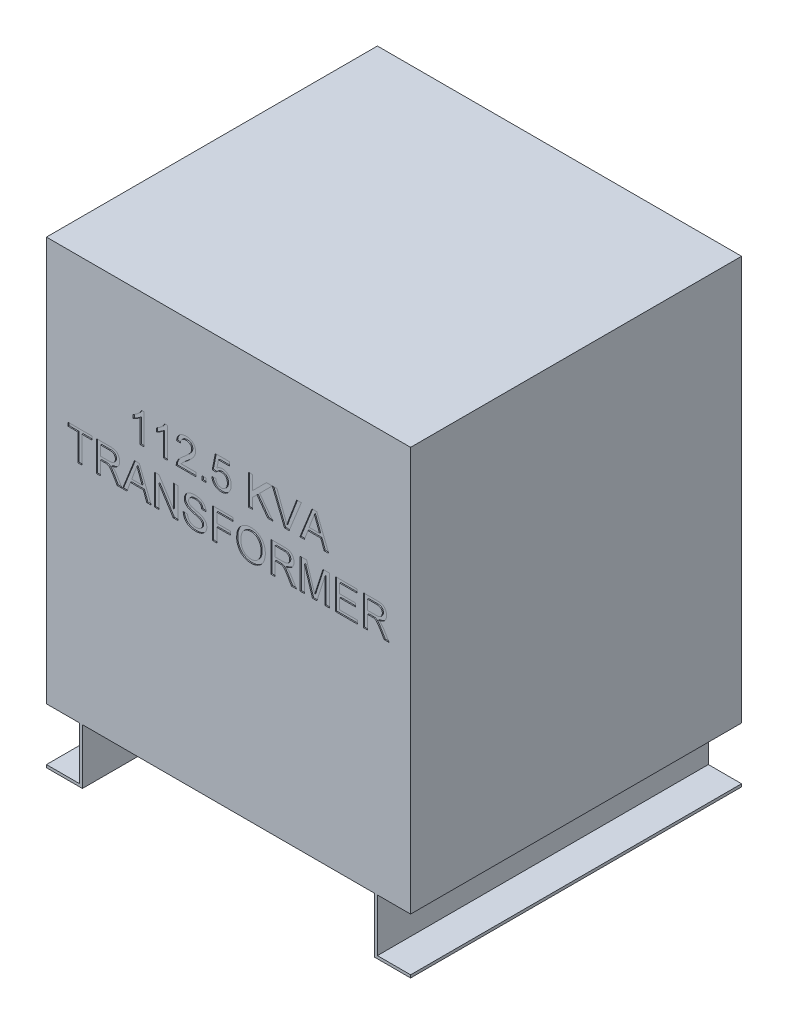
from build123d import *

# Parameters (mm, degrees)
SKETCH1_W           = 835.66
SKETCH1_H           = 759.46
BOSS_EXTRUDE1_DEPTH = 1054.608
SKETCH2_W           = 670.56
SKETCH2_H           = 127
SKETCH2_W_2         = 76.2
SKETCH2_H_2         = 120.65
CUT_EXTRUDE1_DEPTH  = 1366.12249786
SKETCH3_W           = 8.890333909
SKETCH3_H           = 8.890333909
CUT_EXTRUDE2_DEPTH  = 2.54


with BuildPart() as part:
    # Sketch1 → Boss-Extrude1 (new body)
    with BuildSketch(Plane(origin=(0, 0, 0), x_dir=(1, 0, 0), z_dir=(0, 1, 0))):
        Rectangle(SKETCH1_W, SKETCH1_H)
    extrude(amount=BOSS_EXTRUDE1_DEPTH)

    # Sketch2 → Cut-Extrude1 (cut, through all)
    with BuildSketch(Plane.XY.offset(379.73)):
        with Locations((0, 63.5)):
            Rectangle(SKETCH2_W, SKETCH2_H)
        with Locations((-379.73, 66.675)):
            Rectangle(SKETCH2_W_2, SKETCH2_H_2)
        with Locations((379.73, 66.675)):
            Rectangle(SKETCH2_W_2, SKETCH2_H_2)
    extrude(amount=-CUT_EXTRUDE1_DEPTH, mode=Mode.SUBTRACT)

    # Sketch3 → Cut-Extrude2 (cut)
    # profile 1 of 19: a face of its own
    with BuildSketch(Plane.XY.offset(379.73)):
        with BuildLine():
            Line((-193.809279222, 749.808), (-202.699613131, 749.808))
            Line((-202.699613131, 749.808), (-202.699613131, 803.844560792))
            add(Edge.make_bspline(
                [(-202.699613131, 803.844560792), (-203.211519344, 803.350890231), (-204.275460308, 802.324850069), (-206.073940112, 800.872747029), (-208.081273417, 799.400979046), (-210.271393721, 797.985709594), (-212.503850874, 796.653386029), (-214.661233291, 795.455165815), (-216.707522554, 794.441180792), (-218.055424344, 793.88672977), (-218.702214168, 793.620676797)],
                knots=[0, 0, 0, 0, 0.893362401, 1.856755847, 2.901947673, 4.020460078, 5.132200827, 6.168787962, 7.121294059, 8, 8, 8, 8], degree=3))
            Line((-218.702214168, 793.620676797), (-218.702214168, 801.816453369))
            add(Edge.make_bspline(
                [(-218.702214168, 801.816453369), (-217.591285805, 802.3885837), (-215.401711785, 803.516218704), (-212.308317166, 805.463799372), (-209.420300529, 807.57505699), (-206.785469982, 809.849524124), (-204.423512292, 812.17443783), (-202.433056247, 814.52036708), (-200.767569289, 816.801320243), (-199.931962931, 818.392032118), (-199.532431676, 819.152604492)],
                knots=[0, 0, 0, 0, 1.141258006, 2.249351951, 3.335817539, 4.406819942, 5.426913362, 6.360259544, 7.215985427, 8, 8, 8, 8], degree=3))
            Line((-199.532431676, 819.152604492), (-193.809279222, 819.152604492))
            Line((-193.809279222, 819.152604492), (-193.809279222, 749.808))
        make_face()
    # profile 2 of 19: a face of its own
    with BuildSketch(Plane.XY.offset(379.73)):
        with BuildLine():
            Line((-140.467275766, 749.808), (-149.357609675, 749.808))
            Line((-149.357609675, 749.808), (-149.357609675, 803.844560792))
            add(Edge.make_bspline(
                [(-149.357609675, 803.844560792), (-149.869515889, 803.350890231), (-150.933456853, 802.324850069), (-152.731936657, 800.872747029), (-154.739269961, 799.400979046), (-156.929390266, 797.985709594), (-159.161847418, 796.653386029), (-161.319229836, 795.455165815), (-163.365519099, 794.441180792), (-164.713420889, 793.88672977), (-165.360210712, 793.620676797)],
                knots=[0, 0, 0, 0, 0.893362401, 1.856755847, 2.901947673, 4.020460078, 5.132200827, 6.168787962, 7.121294059, 8, 8, 8, 8], degree=3))
            Line((-165.360210712, 793.620676797), (-165.360210712, 801.816453369))
            add(Edge.make_bspline(
                [(-165.360210712, 801.816453369), (-164.24928235, 802.3885837), (-162.05970833, 803.516218704), (-158.966313711, 805.463799372), (-156.078297073, 807.57505699), (-153.443466527, 809.849524124), (-151.081508837, 812.17443783), (-149.091052791, 814.52036708), (-147.425565833, 816.801320243), (-146.589959475, 818.392032118), (-146.19042822, 819.152604492)],
                knots=[0, 0, 0, 0, 1.141258006, 2.249351951, 3.335817539, 4.406819942, 5.426913362, 6.360259544, 7.215985427, 8, 8, 8, 8], degree=3))
            Line((-146.19042822, 819.152604492), (-140.467275766, 819.152604492))
            Line((-140.467275766, 819.152604492), (-140.467275766, 749.808))
        make_face()
    # profile 3 of 19: a face of its own
    with BuildSketch(Plane.XY.offset(379.73)):
        with BuildLine():
            Line((-74.678804838, 758.698333909), (-74.678804838, 749.808))
            Line((-74.678804838, 749.808), (-120.019507775, 749.808))
            add(Edge.make_bspline(
                [(-120.019507775, 749.808), (-120.020436018, 750.336377538), (-120.022289393, 751.391361613), (-119.843769094, 752.951616136), (-119.564170563, 754.491172572), (-119.248028603, 755.478428886), (-119.088800944, 755.97566915)],
                knots=[0, 0, 0, 0, 1.01057331, 2.01775941, 3.001627217, 4, 4, 4, 4], degree=3))
            add(Edge.make_bspline(
                [(-119.088800944, 755.97566915), (-118.794601205, 756.788100418), (-118.195562082, 758.442344284), (-116.981902544, 760.829187169), (-115.554352121, 763.2015949), (-114.164430839, 765.133069743), (-112.891563084, 766.676183111), (-111.824097555, 767.883490735), (-110.641150068, 769.11931236), (-109.343667975, 770.383422244), (-107.944138762, 771.684007516), (-106.440652781, 773.025405576), (-104.815456221, 774.382618005), (-103.680898933, 775.282234872), (-103.100091054, 775.742770951)],
                knots=[0, 0, 0, 0, 1.204657718, 2.452881516, 3.728232997, 5.065887527, 5.768225529, 6.518857853, 7.313994055, 8.154655305, 9.046094665, 9.979688118, 10.965752482, 12, 12, 12, 12], degree=3))
            add(Edge.make_bspline(
                [(-103.100091054, 775.742770951), (-102.207826686, 776.493775384), (-100.489715049, 777.939882058), (-98.063472181, 780.085770335), (-95.84749425, 782.078349148), (-93.87706819, 783.952542514), (-92.136077984, 785.690171969), (-90.620435755, 787.287300687), (-89.31710045, 788.738944353), (-88.241983239, 790.097646317), (-87.334873859, 791.380638897), (-86.566178777, 792.632118928), (-85.925573418, 793.873947026), (-85.392034868, 795.102193707), (-84.970051209, 796.322111502), (-84.682409317, 797.537254588), (-84.487340537, 798.735565791), (-84.467823748, 799.532935363), (-84.458172138, 799.927257413)],
                knots=[0, 0, 0, 0, 1.782554561, 3.432421876, 4.950675607, 6.337395053, 7.588547463, 8.709982106, 9.702713005, 10.569305638, 11.356701089, 12.103210377, 12.812277205, 13.490692607, 14.148717897, 14.782152033, 15.397739362, 16, 16, 16, 16], degree=3))
            add(Edge.make_bspline(
                [(-84.458172138, 799.927257413), (-84.467824909, 800.316978608), (-84.486763122, 801.081590396), (-84.666447943, 802.200594967), (-84.916583624, 803.278223105), (-85.320976889, 804.295075147), (-85.802326615, 805.281264028), (-86.419773819, 806.205627439), (-87.134033306, 807.091202874), (-87.951799967, 807.914641885), (-88.844992667, 808.687159141), (-89.843008224, 809.329308645), (-90.880297248, 809.907434532), (-91.99264534, 810.372280908), (-93.178244991, 810.713625894), (-94.428465593, 810.961354446), (-95.74310876, 811.118427624), (-96.640260309, 811.140179038), (-97.099115665, 811.151303974)],
                knots=[0, 0, 0, 0, 0.988194508, 1.938783882, 2.870742509, 3.789494954, 4.709148727, 5.651055405, 6.603531303, 7.592354411, 8.592907906, 9.593461401, 10.59787167, 11.603930315, 12.645063138, 13.723588815, 14.835711238, 16, 16, 16, 16], degree=3))
            add(Edge.make_bspline(
                [(-97.099115665, 811.151303974), (-97.58113046, 811.140234135), (-98.524468837, 811.118569646), (-99.903376917, 810.960870034), (-101.21241112, 810.719926341), (-102.448446987, 810.351544054), (-103.609980105, 809.887472835), (-104.692279805, 809.303330764), (-105.712678211, 808.64394002), (-106.639039052, 807.86327112), (-107.47673501, 806.997668555), (-108.220414005, 806.055289196), (-108.829747201, 805.017947091), (-109.33295967, 803.90845106), (-109.737584625, 802.723313268), (-110.031328581, 801.453473576), (-110.191479755, 800.102598465), (-110.223684813, 799.177519566), (-110.240140475, 798.704836501)],
                knots=[0, 0, 0, 0, 1.131143733, 2.213731411, 3.253917892, 4.251203413, 5.236093891, 6.184197493, 7.13373276, 8.082770301, 9.020476205, 9.957489029, 10.893177274, 11.836722509, 12.812818608, 13.827831385, 14.890097571, 16, 16, 16, 16], degree=3))
            Line((-110.240140475, 798.704836501), (-119.130474384, 799.593869892))
            add(Edge.make_bspline(
                [(-119.130474384, 799.593869892), (-119.039513638, 800.368684215), (-118.862557337, 801.87601879), (-118.421783332, 804.05913903), (-117.802976517, 806.090066638), (-117.062521938, 807.997117013), (-116.134292356, 809.747826413), (-115.085008713, 811.378406299), (-113.847427065, 812.837141513), (-112.480227691, 814.17001348), (-110.968431423, 815.344624398), (-109.326239246, 816.370810112), (-107.554402354, 817.229151103), (-105.662789255, 817.939821659), (-103.647057267, 818.479025295), (-101.510057991, 818.865685179), (-99.248354748, 819.104026752), (-97.697024959, 819.136180871), (-96.904639611, 819.152604492)],
                knots=[0, 0, 0, 0, 1.130804643, 2.199883102, 3.223565206, 4.205909148, 5.160801384, 6.091796021, 7.01151579, 7.927798993, 8.855738875, 9.7815393, 10.730299821, 11.705391175, 12.706931101, 13.751121791, 14.851322166, 16, 16, 16, 16], degree=3))
            add(Edge.make_bspline(
                [(-96.904639611, 819.152604492), (-96.10276985, 819.138873382), (-94.540722832, 819.112125098), (-92.264569255, 818.83843645), (-90.116955446, 818.412168876), (-88.090008314, 817.818082383), (-86.195703344, 817.039057835), (-84.432583378, 816.087265743), (-82.792519037, 814.971990569), (-81.302912433, 813.679844157), (-79.959695218, 812.269249897), (-78.782563391, 810.763841736), (-77.79842452, 809.170050806), (-76.960491372, 807.509601581), (-76.33896543, 805.74740985), (-75.901896935, 803.907432946), (-75.604896217, 801.988098554), (-75.580355114, 800.678532309), (-75.567838229, 800.010604294)],
                knots=[0, 0, 0, 0, 1.195390245, 2.328627238, 3.413424916, 4.457841177, 5.473507151, 6.462241215, 7.441013641, 8.425227782, 9.397253344, 10.342087291, 11.269524934, 12.186751184, 13.110685745, 14.048630397, 15.004728144, 16, 16, 16, 16], degree=3))
            add(Edge.make_bspline(
                [(-75.567838229, 800.010604294), (-75.586951309, 799.324383939), (-75.62521965, 797.950428858), (-75.923909145, 795.896771212), (-76.434970205, 793.86540032), (-77.11250077, 791.831593184), (-78.038148538, 789.787277707), (-79.207547309, 787.704252504), (-80.658314264, 785.574823059), (-82.05354532, 783.764571451), (-83.352278987, 782.247124109), (-84.503483646, 780.998176287), (-85.835360809, 779.671252745), (-87.29794678, 778.220399052), (-88.950892845, 776.697109039), (-90.746706021, 775.055766906), (-92.724697507, 773.339566534), (-94.097809094, 772.16714082), (-94.807076454, 771.561535784)],
                knots=[0, 0, 0, 0, 0.927118007, 1.856282007, 2.79721255, 3.754929441, 4.749232485, 5.824981375, 6.979078785, 8.228161913, 8.911614355, 9.677694854, 10.522803217, 11.452009355, 12.461436787, 13.560019032, 14.739651695, 16, 16, 16, 16], degree=3))
            add(Edge.make_bspline(
                [(-94.807076454, 771.561535784), (-95.414456817, 771.067063422), (-96.572637676, 770.12418074), (-98.220374319, 768.757258456), (-99.696245181, 767.503827753), (-101.034763268, 766.404773173), (-102.18718063, 765.406934818), (-103.194089542, 764.554013652), (-104.018908458, 763.803125112), (-105.274961642, 762.66251027), (-106.865860167, 761.036679096), (-108.038102245, 759.456904364), (-108.60098516, 758.698333909)],
                knots=[0, 0, 0, 0, 1.241996727, 2.368296581, 3.394949853, 4.3125351, 5.114548721, 5.812230366, 6.404953749, 6.883082049, 8.503329734, 10, 10, 10, 10], degree=3))
            Line((-108.60098516, 758.698333909), (-74.678804838, 758.698333909))
        make_face()
    # profile 4 of 19: a face of its own
    with BuildSketch(Plane.XY.offset(379.73)):
        with Locations((-56.009103629, 754.253166955)):
            Rectangle(SKETCH3_W, SKETCH3_H)
    # profile 5 of 19: a face of its own
    with BuildSketch(Plane.XY.offset(379.73)):
        with BuildLine():
            Line((-38.22843581, 768.477701209), (-29.338101901, 769.3667346))
            add(Edge.make_bspline(
                [(-29.338101901, 769.3667346), (-29.250073638, 768.865813077), (-29.078844975, 767.891442808), (-28.752549835, 766.481012942), (-28.32878533, 765.170684174), (-27.852639255, 763.949108308), (-27.286659318, 762.829201978), (-26.673415366, 761.79328245), (-25.950219453, 760.878121638), (-25.189876052, 760.035855768), (-24.355341072, 759.29367058), (-23.438561873, 758.667982862), (-22.465117198, 758.122108216), (-21.423150858, 757.675170308), (-20.311065916, 757.348035297), (-19.143016243, 757.089327663), (-17.903961086, 756.958966107), (-17.058562209, 756.933331743), (-16.62770264, 756.920267127)],
                knots=[0, 0, 0, 0, 1.237781394, 2.407677316, 3.51963579, 4.58689595, 5.594855907, 6.570874, 7.510833816, 8.428091223, 9.330271693, 10.221190844, 11.124215526, 12.043132878, 12.973586933, 13.941700858, 14.950982896, 16, 16, 16, 16], degree=3))
            add(Edge.make_bspline(
                [(-16.62770264, 756.920267127), (-16.09913447, 756.933038869), (-15.065496386, 756.958014565), (-13.561748774, 757.169248973), (-12.141337369, 757.517550039), (-10.811058621, 758.004971506), (-9.555317593, 758.611137775), (-8.415772728, 759.396012674), (-7.330289758, 760.278289615), (-6.368719759, 761.330133056), (-5.4934209, 762.475240339), (-4.737972179, 763.72517365), (-4.101991091, 765.062389184), (-3.566564528, 766.486630573), (-3.171191083, 768.006034014), (-2.880361979, 769.61251657), (-2.693661304, 771.307101572), (-2.676079434, 772.468592841), (-2.667100173, 773.061779631)],
                knots=[0, 0, 0, 0, 1.052816602, 2.058828735, 3.018813999, 3.961574988, 4.877590722, 5.788574389, 6.712363302, 7.658909047, 8.620312049, 9.580784896, 10.562948504, 11.56722449, 12.607883026, 13.686460295, 14.818448981, 16, 16, 16, 16], degree=3))
            add(Edge.make_bspline(
                [(-2.667100173, 773.061779631), (-2.677305855, 773.627078913), (-2.697178686, 774.727847723), (-2.864540342, 776.330750132), (-3.146899158, 777.837963479), (-3.512245029, 779.266099888), (-4.015828231, 780.592842967), (-4.613106264, 781.837429194), (-5.344796957, 782.973444785), (-6.158851136, 784.036261152), (-7.088603782, 784.989033199), (-8.146615697, 785.793528516), (-9.291381699, 786.497624387), (-10.545958548, 787.068602215), (-11.911084999, 787.492817285), (-13.373195458, 787.81921261), (-14.947461485, 787.990883186), (-16.030027647, 788.020978817), (-16.586029199, 788.03643581)],
                knots=[0, 0, 0, 0, 1.165854935, 2.270189951, 3.319242023, 4.32700288, 5.306253956, 6.24172124, 7.169108591, 8.088047231, 8.999810445, 9.905349262, 10.822648491, 11.767237767, 12.739852311, 13.766490849, 14.852878837, 16, 16, 16, 16], degree=3))
            add(Edge.make_bspline(
                [(-16.586029199, 788.03643581), (-17.277390149, 788.016212151), (-18.603263991, 787.977427749), (-20.508408356, 787.651148487), (-22.242730248, 787.124085902), (-23.786593733, 786.338563242), (-25.165959469, 785.400127398), (-26.409483036, 784.338244667), (-27.527418549, 783.153632978), (-28.140651691, 782.261757873), (-28.44906851, 781.813202073)],
                knots=[0, 0, 0, 0, 1.182877094, 2.268490576, 3.298955169, 4.273890847, 5.221533034, 6.149304476, 7.069219215, 8, 8, 8, 8], degree=3))
            Line((-28.44906851, 781.813202073), (-37.339402419, 782.702235464))
            Line((-37.339402419, 782.702235464), (-30.227135291, 818.263571101))
            Line((-30.227135291, 818.263571101), (2.667100173, 818.263571101))
            Line((2.667100173, 818.263571101), (2.667100173, 809.373237192))
            Line((2.667100173, 809.373237192), (-22.96206555, 809.373237192))
            Line((-22.96206555, 809.373237192), (-26.49041682, 791.411984466))
            add(Edge.make_bspline(
                [(-26.49041682, 791.411984466), (-25.999872004, 791.780096172), (-25.036519582, 792.503009332), (-23.533862478, 793.449568826), (-22.009718954, 794.247455363), (-20.472961438, 794.900857341), (-18.911382802, 795.409856333), (-17.334406336, 795.763485329), (-15.7366627, 796.002488612), (-14.665281356, 796.025953588), (-14.127296228, 796.037736328)],
                knots=[0, 0, 0, 0, 1.093835215, 2.148119334, 3.164235237, 4.159999629, 5.123971815, 6.089888814, 7.040853737, 8, 8, 8, 8], degree=3))
            add(Edge.make_bspline(
                [(-14.127296228, 796.037736328), (-13.42714505, 796.019391812), (-12.048377578, 795.98326701), (-10.016715967, 795.68645628), (-8.074105704, 795.182600389), (-6.205309117, 794.503979962), (-4.434968471, 793.604352659), (-2.745151487, 792.515095021), (-1.142680542, 791.2272286), (0.363385135, 789.76505278), (1.7294466, 788.141883902), (2.952116196, 786.410659401), (3.950725936, 784.536724924), (4.790625266, 782.569009221), (5.424095324, 780.475211525), (5.904921208, 778.285047101), (6.162002846, 775.971133893), (6.202503999, 774.395897638), (6.223233736, 773.589643207)],
                knots=[0, 0, 0, 0, 0.991958705, 1.953407265, 2.902004973, 3.832128134, 4.765371166, 5.71007953, 6.676509202, 7.674246545, 8.68000108, 9.679398714, 10.671856529, 11.683459888, 12.706765812, 13.76733029, 14.85725088, 16, 16, 16, 16], degree=3))
            add(Edge.make_bspline(
                [(6.223233736, 773.589643207), (6.207492545, 772.820343932), (6.176399202, 771.30075835), (5.921582818, 769.061368079), (5.501833385, 766.903539289), (4.939904718, 764.820881985), (4.18066368, 762.825224051), (3.259775365, 760.910119348), (2.197479041, 759.055584408), (1.345572517, 757.912370652), (0.916815684, 757.337001529)],
                knots=[0, 0, 0, 0, 1.059692978, 2.093196008, 3.100373587, 4.086253034, 5.061402885, 6.037282833, 7.012182238, 8, 8, 8, 8], degree=3))
            add(Edge.make_bspline(
                [(0.916815684, 757.337001529), (0.37209215, 756.665364686), (-0.699437527, 755.344182905), (-2.554779465, 753.629368029), (-4.549298354, 752.172011385), (-6.694863817, 750.988014729), (-8.977071979, 750.036573155), (-11.423959143, 749.403424514), (-14.005958885, 748.978240122), (-15.778551803, 748.938996301), (-16.683267227, 748.918966609)],
                knots=[0, 0, 0, 0, 1.023140956, 2.012628108, 2.982342558, 3.942221589, 4.908720554, 5.902469194, 6.929439212, 8, 8, 8, 8], degree=3))
            add(Edge.make_bspline(
                [(-16.683267227, 748.918966609), (-17.429513912, 748.934104101), (-18.889322223, 748.963716075), (-21.026741324, 749.221148548), (-23.059679641, 749.631662569), (-24.988774062, 750.220466755), (-26.819836429, 750.964475948), (-28.531583027, 751.90962274), (-30.153719375, 752.990811801), (-31.650563878, 754.241354369), (-33.014384112, 755.636190099), (-34.236394739, 757.145765428), (-35.300058627, 758.771064709), (-36.204862399, 760.502362513), (-36.958974562, 762.337998475), (-37.535900183, 764.290501514), (-37.992873285, 766.340714566), (-38.149091657, 767.757903382), (-38.22843581, 768.477701209)],
                knots=[0, 0, 0, 0, 1.108768375, 2.168973506, 3.19473529, 4.187459816, 5.162590879, 6.12651078, 7.088512529, 8.056012598, 9.019588496, 9.983680353, 10.938070192, 11.90157236, 12.88306954, 13.882379887, 14.924449348, 16, 16, 16, 16], degree=3))
        make_face()
    # profile 6 of 19: a face of its own
    with BuildSketch(Plane.XY.offset(379.73)):
        Polygon((45.340702937, 749.808), (45.340702937, 819.152604492), (55.120070237, 819.152604492), (55.120070237, 787.202967006), (87.069707724, 819.152604492), (100.460773175, 819.152604492), (71.483841089, 790.175672407), (102.238839956, 749.808), (90.195215739, 749.808), (65.288389646, 783.966329817), (55.120070237, 773.811901555), (55.120070237, 749.808), align=None)
    # profile 7 of 19: a face of its own
    with BuildSketch(Plane.XY.offset(379.73)):
        with BuildLine():
            Line((128.493107282, 749.808), (100.530228908, 819.152604492))
            Line((100.530228908, 819.152604492), (111.129173866, 819.152604492))
            Line((111.129173866, 819.152604492), (129.993351129, 769.450081481))
            add(Edge.make_bspline(
                [(129.993351129, 769.450081481), (130.36250438, 768.469677885), (131.084644272, 766.551806254), (132.091668925, 763.705816244), (132.99188834, 760.953598841), (133.534619226, 759.139349514), (133.799525334, 758.253817214)],
                knots=[0, 0, 0, 0, 1.062747156, 2.078952616, 3.062339733, 4, 4, 4, 4], degree=3))
            add(Edge.make_bspline(
                [(133.799525334, 758.253817214), (134.36347141, 760.126408418), (135.499449182, 763.898439252), (136.872575929, 767.590773683), (137.564026099, 769.450081481)],
                knots=[0, 0, 0, 0, 0.992882236, 2, 2, 2, 2], degree=3))
            Line((137.564026099, 769.450081481), (156.469876803, 819.152604492))
            Line((156.469876803, 819.152604492), (167.06882176, 819.152604492))
            Line((167.06882176, 819.152604492), (139.09205224, 749.808))
            Line((139.09205224, 749.808), (128.493107282, 749.808))
        make_face()
    # profile 8 of 19: a face of its own
    with BuildSketch(Plane.XY.offset(379.73)):
        Polygon((163.873858012, 749.808), (191.406110837, 819.152604492), (202.435681343, 819.152604492), (229.967934168, 749.808), (219.591247559, 749.808), (211.701076214, 771.144801382), (182.140715966, 771.144801382), (174.250544621, 749.808), align=None)
        with BuildLine():
            Line((185.085639073, 779.146101901), (208.756153107, 779.146101901))
            Line((208.756153107, 779.146101901), (202.018946941, 797.371286415))
            add(Edge.make_bspline(
                [(202.018946941, 797.371286415), (201.76066651, 798.075482707), (201.255679502, 799.452319422), (200.502591732, 801.452746939), (199.814582881, 803.352435016), (199.139933705, 805.124144846), (198.530915843, 806.793612296), (197.96956847, 808.349560868), (197.414400654, 809.781175976), (197.081236638, 810.706146847), (196.92089609, 811.151303974)],
                knots=[0, 0, 0, 0, 1.225184869, 2.395467751, 3.491410812, 4.525364584, 5.492066482, 6.394148129, 7.227157926, 8, 8, 8, 8], degree=3))
            add(Edge.make_bspline(
                [(196.92089609, 811.151303974), (196.655661875, 810.053585701), (196.124099802, 807.853622918), (195.01113824, 804.630382311), (193.737948868, 801.436619695), (192.70396739, 799.378580867), (192.184015054, 798.343666686)],
                knots=[0, 0, 0, 0, 0.9891762, 1.982431084, 2.985436691, 4, 4, 4, 4], degree=3))
            Line((192.184015054, 798.343666686), (185.085639073, 779.146101901))
        make_face(mode=Mode.SUBTRACT)
    # profile 9 of 19: a face of its own
    with BuildSketch(Plane.XY.offset(379.73)):
        Polygon((-345.83398907, 642.123993089), (-345.83398907, 703.467297063), (-368.059823843, 703.467297063), (-368.059823843, 711.468597581), (-313.828786997, 711.468597581), (-313.828786997, 703.467297063), (-336.05462177, 703.467297063), (-336.05462177, 642.123993089), align=None)
    # profile 10 of 19: a face of its own
    with BuildSketch(Plane.XY.offset(379.73)):
        with BuildLine():
            Line((-303.160386306, 642.123993089), (-303.160386306, 711.468597581))
            Line((-303.160386306, 711.468597581), (-273.072162481, 711.468597581))
            add(Edge.make_bspline(
                [(-273.072162481, 711.468597581), (-272.36367694, 711.463046304), (-270.9924861, 711.452302456), (-269.003976261, 711.376248216), (-267.147901674, 711.212295227), (-265.420849637, 711.035002919), (-263.823126999, 710.762882906), (-262.356382086, 710.450767398), (-261.018350318, 710.079345224), (-259.803049885, 709.640667005), (-258.675516081, 709.144368317), (-257.630377412, 708.532015865), (-256.624188813, 707.861008146), (-255.694293451, 707.072674213), (-254.816165247, 706.209521525), (-253.990618076, 705.259821668), (-253.229873508, 704.215333178), (-252.291586187, 702.720453542), (-251.284995194, 700.729588665), (-250.446346788, 698.181712997), (-249.905601299, 695.51654205), (-249.847739986, 693.695206453), (-249.81838285, 692.771114078)],
                knots=[0, 0, 0, 0, 1.242255013, 2.404239178, 3.487702428, 4.508875116, 5.447164253, 6.327763259, 7.137389581, 7.87956647, 8.591787438, 9.293660819, 10.000726923, 10.709654955, 11.427269343, 12.158170644, 12.913245971, 13.690346794, 15.251572448, 16.809945773, 18.381459854, 20, 20, 20, 20], degree=3))
            add(Edge.make_bspline(
                [(-249.81838285, 692.771114078), (-249.831952384, 692.177929187), (-249.858753145, 691.006348348), (-250.064049669, 689.283810919), (-250.435517153, 687.637995671), (-250.911850984, 686.054488851), (-251.563806684, 684.555726219), (-252.319069065, 683.111095092), (-253.254731775, 681.760283341), (-254.302309647, 680.467321014), (-255.503600543, 679.259899913), (-256.869172193, 678.181580823), (-258.385488, 677.211630642), (-260.059689201, 676.376810674), (-261.872504058, 675.61374559), (-263.846678418, 674.999288818), (-265.974244677, 674.497537746), (-267.449172505, 674.254570514), (-268.210261125, 674.129195162)],
                knots=[0, 0, 0, 0, 0.982609109, 1.940720374, 2.867584677, 3.775009516, 4.675469332, 5.571146231, 6.471115823, 7.392408543, 8.32534739, 9.286126426, 10.269214477, 11.301811357, 12.381622301, 13.524260118, 14.722474812, 16, 16, 16, 16], degree=3))
            add(Edge.make_bspline(
                [(-268.210261125, 674.129195162), (-267.651973788, 673.847160714), (-266.591766037, 673.311567144), (-265.123895269, 672.471761078), (-263.87963203, 671.613686224), (-263.158767285, 670.999965866), (-262.820496192, 670.711973066)],
                knots=[0, 0, 0, 0, 1.172304973, 2.226249348, 3.167654437, 4, 4, 4, 4], degree=3))
            add(Edge.make_bspline(
                [(-262.820496192, 670.711973066), (-262.165415109, 670.069802167), (-260.819832026, 668.750737521), (-258.96556009, 666.503984026), (-257.167779766, 664.003002627), (-256.075492667, 662.195534894), (-255.513753011, 661.265993287)],
                knots=[0, 0, 0, 0, 0.918110279, 1.885863737, 2.912745394, 4, 4, 4, 4], degree=3))
            Line((-255.513753011, 661.265993287), (-244.136903836, 642.123993089))
            Line((-244.136903836, 642.123993089), (-255.34705925, 642.123993089))
            Line((-255.34705925, 642.123993089), (-263.987352518, 656.765261746))
            add(Edge.make_bspline(
                [(-263.987352518, 656.765261746), (-264.298014064, 657.278968255), (-264.90002513, 658.274447121), (-265.769608548, 659.728296082), (-266.622206498, 661.066795697), (-267.412976514, 662.328201014), (-268.174009367, 663.489611841), (-268.8979517, 664.555062694), (-269.564880296, 665.538530895), (-270.390957586, 666.683543818), (-271.35237435, 667.950511244), (-272.474281748, 669.255248444), (-273.542670223, 670.295498034), (-274.858410349, 671.315573413), (-276.488153549, 672.269682465), (-277.873466034, 672.708069363), (-278.545274294, 672.920665396)],
                knots=[0, 0, 0, 0, 1.130940588, 2.191577161, 3.191089816, 4.120344442, 4.99615009, 5.80661983, 6.546979556, 7.234477901, 8.466216387, 9.541989141, 10.473533583, 11.269175393, 12.675684693, 14, 14, 14, 14], degree=3))
            add(Edge.make_bspline(
                [(-278.545274294, 672.920665396), (-278.827140141, 672.971495388), (-279.47064832, 673.087541783), (-280.563323601, 673.163331869), (-281.887233756, 673.243772905), (-282.846694007, 673.241429123), (-283.365502211, 673.240161771)],
                knots=[0, 0, 0, 0, 0.709978628, 1.620902492, 2.713552433, 4, 4, 4, 4], degree=3))
            Line((-283.365502211, 673.240161771), (-293.381019005, 673.240161771))
            Line((-293.381019005, 673.240161771), (-293.381019005, 642.123993089))
            Line((-293.381019005, 642.123993089), (-303.160386306, 642.123993089))
        make_face()
        with BuildLine():
            Line((-293.381019005, 681.24146229), (-274.808555823, 681.24146229))
            add(Edge.make_bspline(
                [(-274.808555823, 681.24146229), (-273.877262169, 681.256033262), (-272.136296032, 681.283272328), (-269.701830309, 681.515865324), (-267.627123845, 681.885465472), (-265.871162653, 682.424570574), (-264.39587808, 683.173027479), (-263.112795056, 684.085162079), (-262.046536912, 685.22770562), (-261.15952028, 686.516822752), (-260.470024055, 687.935431807), (-259.972654365, 689.425472631), (-259.647117252, 690.974422396), (-259.614351598, 692.028616163), (-259.59775015, 692.562746877)],
                knots=[0, 0, 0, 0, 1.546323217, 2.890706218, 4.056530419, 5.041445823, 5.928701482, 6.793137403, 7.641659452, 8.509781392, 9.383301667, 10.251423607, 11.114044887, 12, 12, 12, 12], degree=3))
            add(Edge.make_bspline(
                [(-259.59775015, 692.562746877), (-259.610657082, 692.951988239), (-259.63593797, 693.714397723), (-259.768468746, 694.833403171), (-260.026140039, 695.896716994), (-260.36639435, 696.90995999), (-260.821043155, 697.865710878), (-261.361147388, 698.771375671), (-262.005658474, 699.621934809), (-262.743908839, 700.419979225), (-263.591554418, 701.146121652), (-264.559764947, 701.772625071), (-265.640904205, 702.30501782), (-266.836228841, 702.727560296), (-268.141973364, 703.065525495), (-269.565571091, 703.290362841), (-271.100511604, 703.453054395), (-272.164136366, 703.462460811), (-272.710992666, 703.467297063)],
                knots=[0, 0, 0, 0, 0.965208469, 1.890559848, 2.786986821, 3.67262109, 4.535197034, 5.405224191, 6.282113641, 7.175449223, 8.095446547, 9.040936516, 10.026471658, 11.075712529, 12.17809725, 13.364958037, 14.645208957, 16, 16, 16, 16], degree=3))
            Line((-272.710992666, 703.467297063), (-293.381019005, 703.467297063))
            Line((-293.381019005, 703.467297063), (-293.381019005, 681.24146229))
        make_face(mode=Mode.SUBTRACT)
    # profile 11 of 19: a face of its own
    with BuildSketch(Plane.XY.offset(379.73)):
        Polygon((-243.303435032, 642.123993089), (-215.771182207, 711.468597581), (-204.741611701, 711.468597581), (-177.209358876, 642.123993089), (-187.586045485, 642.123993089), (-195.47621683, 663.460794471), (-225.036577078, 663.460794471), (-232.926748422, 642.123993089), align=None)
        with BuildLine():
            Line((-222.091653971, 671.462094989), (-198.421139937, 671.462094989))
            Line((-198.421139937, 671.462094989), (-205.158346103, 689.687279503))
            add(Edge.make_bspline(
                [(-205.158346103, 689.687279503), (-205.416626533, 690.391475796), (-205.921613542, 691.768312511), (-206.674701312, 693.768740028), (-207.362710163, 695.668428105), (-208.037359339, 697.440137935), (-208.646377201, 699.109605385), (-209.207724574, 700.665553957), (-209.76289239, 702.097169065), (-210.096056406, 703.022139936), (-210.256396954, 703.467297063)],
                knots=[0, 0, 0, 0, 1.225184869, 2.395467751, 3.491410812, 4.525364584, 5.492066482, 6.394148129, 7.227157926, 8, 8, 8, 8], degree=3))
            add(Edge.make_bspline(
                [(-210.256396954, 703.467297063), (-210.521631169, 702.369578789), (-211.053193242, 700.169616007), (-212.166154804, 696.9463754), (-213.439344175, 693.752612784), (-214.473325654, 691.694573956), (-214.99327799, 690.659659775)],
                knots=[0, 0, 0, 0, 0.9891762, 1.982431084, 2.985436691, 4, 4, 4, 4], degree=3))
            Line((-214.99327799, 690.659659775), (-222.091653971, 671.462094989))
        make_face(mode=Mode.SUBTRACT)
    # profile 12 of 19: a face of its own
    with BuildSketch(Plane.XY.offset(379.73)):
        Polygon((-169.805377667, 642.123993089), (-169.805377667, 711.468597581), (-159.470364497, 711.468597581), (-126.242741511, 659.724076), (-126.242741511, 711.468597581), (-116.463374211, 711.468597581), (-116.463374211, 642.123993089), (-126.798387381, 642.123993089), (-160.026010367, 693.86851467), (-160.026010367, 642.123993089), align=None)
    # profile 13 of 19: a face of its own
    with BuildSketch(Plane.XY.offset(379.73)):
        with BuildLine():
            Line((-104.016906738, 666.127894644), (-94.237539438, 666.127894644))
            add(Edge.make_bspline(
                [(-94.237539438, 666.127894644), (-94.129972071, 665.249841937), (-93.923329367, 663.563055405), (-93.345535727, 661.172289419), (-92.601878031, 659.022745439), (-91.675301043, 657.085895221), (-90.45642432, 655.384961483), (-88.987887533, 653.850745227), (-87.20442953, 652.52220685), (-85.191311995, 651.339894737), (-82.949260881, 650.411592733), (-80.555671356, 649.723427176), (-78.021958756, 649.3156836), (-76.287028291, 649.263106793), (-75.401144468, 649.236260216)],
                knots=[0, 0, 0, 0, 1.125557648, 2.162256852, 3.1243583, 4.018160113, 4.88511607, 5.777380551, 6.711250965, 7.707237736, 8.743031335, 9.791730543, 10.872421559, 12, 12, 12, 12], degree=3))
            add(Edge.make_bspline(
                [(-75.401144468, 649.236260216), (-74.617213579, 649.250769942), (-73.088700145, 649.279061098), (-70.877534614, 649.618907969), (-68.796821423, 650.100971625), (-66.885284817, 650.830168378), (-65.149976258, 651.715641876), (-63.643055184, 652.786642837), (-62.356526129, 653.994437718), (-61.349080626, 655.370839167), (-60.557651555, 656.813077714), (-59.977056517, 658.295550196), (-59.631207951, 659.81002821), (-59.58713785, 660.829047099), (-59.565237192, 661.335449021)],
                knots=[0, 0, 0, 0, 1.267006637, 2.470417599, 3.611360613, 4.716023143, 5.771382139, 6.754486395, 7.697536124, 8.612899418, 9.501261124, 10.352596716, 11.181322154, 12, 12, 12, 12], degree=3))
            add(Edge.make_bspline(
                [(-59.565237192, 661.335449021), (-59.588649402, 661.836721383), (-59.634408534, 662.8164575), (-59.932608119, 664.242830901), (-60.49937857, 665.548376875), (-61.234828363, 666.786381721), (-62.257964597, 667.918268936), (-63.550581765, 668.961202041), (-65.141159468, 669.906735293), (-66.328286428, 670.424564416), (-66.955327254, 670.698081919)],
                knots=[0, 0, 0, 0, 0.942140154, 1.841411588, 2.718743672, 3.605002079, 4.535543111, 5.568170452, 6.715506882, 8, 8, 8, 8], degree=3))
            add(Edge.make_bspline(
                [(-66.955327254, 670.698081919), (-67.199631633, 670.798336374), (-67.751559607, 671.024829401), (-68.697538255, 671.324667171), (-69.820061721, 671.712388002), (-71.146097729, 672.111677356), (-72.668547426, 672.534069649), (-74.384876086, 673.012153685), (-76.294124652, 673.520569889), (-78.342143539, 674.061723559), (-80.410018519, 674.611993854), (-82.385631482, 675.162779467), (-84.203289328, 675.721897417), (-85.87788113, 676.26025081), (-87.400773604, 676.800825276), (-88.776289069, 677.328821047), (-90.006142459, 677.833525789), (-90.757290091, 678.204627445), (-91.112031423, 678.379886063)],
                knots=[0, 0, 0, 0, 0.499201778, 1.127787504, 1.87543728, 2.745208432, 3.745951656, 4.863402235, 6.114490242, 7.482339553, 8.869366102, 10.161191451, 11.360587006, 12.46547846, 13.487450326, 14.41601931, 15.251940103, 16, 16, 16, 16], degree=3))
            add(Edge.make_bspline(
                [(-91.112031423, 678.379886063), (-91.928192283, 678.82079967), (-93.50359515, 679.67187768), (-95.623912926, 681.193607543), (-97.410495901, 682.882248479), (-98.855806832, 684.735351886), (-99.988440453, 686.721577338), (-100.752623405, 688.844301436), (-101.276025643, 691.064992772), (-101.324938946, 692.592066229), (-101.349806566, 693.368433388)],
                knots=[0, 0, 0, 0, 1.158441928, 2.236094408, 3.251151369, 4.220012324, 5.163146324, 6.095083285, 7.031536583, 8, 8, 8, 8], degree=3))
            add(Edge.make_bspline(
                [(-101.349806566, 693.368433388), (-101.316802288, 694.228128877), (-101.251157018, 695.938056965), (-100.668847502, 698.447269838), (-99.740052683, 700.861800047), (-98.682802108, 702.778730998), (-97.651749161, 704.228305604), (-96.796998437, 705.272262736), (-95.838228323, 706.237260757), (-94.804965607, 707.136770388), (-93.678739672, 707.957351913), (-92.487492293, 708.732730202), (-91.188106971, 709.399186448), (-89.362277354, 710.247434822), (-86.919757267, 711.094490147), (-83.844929977, 711.832591418), (-80.608775218, 712.267243911), (-78.40293611, 712.327075787), (-77.276449277, 712.357630972)],
                knots=[0, 0, 0, 0, 1.199927478, 2.386647047, 3.578628709, 4.806592355, 5.433127754, 6.062729195, 6.689531802, 7.331674828, 7.974827539, 8.635320743, 9.315455226, 10.01318112, 11.447700238, 12.918145351, 14.426146008, 16, 16, 16, 16], degree=3))
            add(Edge.make_bspline(
                [(-77.276449277, 712.357630972), (-76.043434613, 712.329378324), (-73.642517482, 712.274364975), (-70.153917029, 711.816663929), (-66.900007843, 711.030670794), (-64.348180616, 710.150830338), (-62.461644589, 709.260111253), (-61.121396866, 708.565092196), (-59.877381951, 707.761523557), (-58.718401201, 706.891936578), (-57.633689253, 705.956728395), (-56.65112564, 704.933653496), (-55.72804471, 703.857617345), (-54.643295985, 702.312766572), (-53.473706892, 700.268165315), (-52.462437917, 697.619303174), (-51.767684336, 694.82364667), (-51.632538778, 692.890937755), (-51.563936674, 691.909862981)],
                knots=[0, 0, 0, 0, 1.607600973, 3.130308851, 4.577334065, 5.967726088, 6.640410691, 7.296826776, 7.935019992, 8.569057421, 9.185393759, 9.8003086, 10.417295362, 11.032210203, 12.259799365, 13.477607022, 14.719591916, 16, 16, 16, 16], degree=3))
            Line((-51.563936674, 691.909862981), (-61.343303974, 691.909862981))
            add(Edge.make_bspline(
                [(-61.343303974, 691.909862981), (-61.405440633, 692.406413611), (-61.527023658, 693.378016027), (-61.828655004, 694.784556695), (-62.251481455, 696.090888376), (-62.746740811, 697.309193495), (-63.347098837, 698.42680034), (-64.046942575, 699.454440381), (-64.854794635, 700.380006264), (-65.749868136, 701.227954988), (-66.7594, 701.966281626), (-67.878202936, 702.607171815), (-69.108165522, 703.14857727), (-70.448204161, 703.592005996), (-71.898584156, 703.935823286), (-73.462604412, 704.188741847), (-75.139660412, 704.318272767), (-76.294622754, 704.343421108), (-76.887497168, 704.356330454)],
                knots=[0, 0, 0, 0, 1.074487479, 2.102453544, 3.083708351, 4.020042547, 4.923259678, 5.803182661, 6.684453325, 7.556870173, 8.445961597, 9.363679789, 10.320905216, 11.327237703, 12.390948353, 13.519046902, 14.726457512, 16, 16, 16, 16], degree=3))
            add(Edge.make_bspline(
                [(-76.887497168, 704.356330454), (-77.503762469, 704.351685337), (-78.696700527, 704.342693534), (-80.421227774, 704.178784198), (-82.019641619, 703.953894776), (-83.489196618, 703.622163754), (-84.825078699, 703.187926733), (-86.047114268, 702.686482616), (-87.121103363, 702.051021954), (-88.072082523, 701.343201425), (-88.892422495, 700.56003711), (-89.599434031, 699.734771273), (-90.224731127, 698.891650818), (-90.710600764, 697.984590227), (-91.106171676, 697.047941263), (-91.361358379, 696.064097994), (-91.542036527, 695.051258962), (-91.560840855, 694.360178581), (-91.570439265, 694.007426137)],
                knots=[0, 0, 0, 0, 1.464176581, 2.834285765, 4.113735764, 5.29917439, 6.409476712, 7.449999357, 8.431575861, 9.367089851, 10.262376129, 11.120706676, 11.948504824, 12.751342953, 13.560717798, 14.359016663, 15.162382702, 16, 16, 16, 16], degree=3))
            add(Edge.make_bspline(
                [(-91.570439265, 694.007426137), (-91.545167078, 693.410815641), (-91.496116094, 692.252849676), (-90.995233822, 690.6077291), (-90.224873384, 689.108095101), (-89.465945608, 688.292151901), (-89.083924, 687.881430428)],
                knots=[0, 0, 0, 0, 1.050964922, 2.039826012, 3.013306874, 4, 4, 4, 4], degree=3))
            add(Edge.make_bspline(
                [(-89.083924, 687.881430428), (-88.843101651, 687.676171489), (-88.310537896, 687.222254018), (-87.319620933, 686.621547392), (-86.09103086, 686.014609903), (-84.616558438, 685.411267072), (-82.898740551, 684.80419438), (-80.940348073, 684.17913839), (-78.733921717, 683.558340931), (-76.34670226, 682.960099864), (-73.935053967, 682.359453822), (-71.643177308, 681.761097017), (-69.538846591, 681.194019425), (-67.625400488, 680.640928124), (-65.900858525, 680.103387056), (-64.371214115, 679.570134043), (-63.024091858, 679.079676534), (-62.198820326, 678.734599633), (-61.815602963, 678.574362117)],
                knots=[0, 0, 0, 0, 0.523891492, 1.158553688, 1.913783773, 2.794766643, 3.797521443, 4.933638669, 6.202080764, 7.596537849, 9.013317056, 10.322179469, 11.523240428, 12.626146501, 13.623953177, 14.517289671, 15.311498917, 16, 16, 16, 16], degree=3))
            add(Edge.make_bspline(
                [(-61.815602963, 678.574362117), (-61.317017723, 678.344482303), (-60.338378451, 677.893266753), (-58.952004876, 677.122884079), (-57.658367923, 676.322883145), (-56.467919312, 675.471725225), (-55.384508341, 674.567619928), (-54.396021208, 673.620926313), (-53.496487799, 672.636964953), (-52.7222042, 671.584243354), (-52.026976968, 670.505317265), (-51.418606845, 669.385107309), (-50.928758906, 668.217025745), (-50.499131709, 667.015152712), (-50.190106523, 665.766119886), (-49.947768448, 664.482543332), (-49.806416701, 663.158389867), (-49.792778038, 662.261854086), (-49.785869892, 661.80774801)],
                knots=[0, 0, 0, 0, 1.198900896, 2.353241543, 3.461831299, 4.520043694, 5.547003373, 6.541368882, 7.508191797, 8.454912692, 9.392021408, 10.310662301, 11.235020644, 12.156274873, 13.095836685, 14.042125239, 15.00831306, 16, 16, 16, 16], degree=3))
            add(Edge.make_bspline(
                [(-49.785869892, 661.80774801), (-49.822059527, 660.901475703), (-49.893907983, 659.102223954), (-50.512549094, 656.450043665), (-51.48440156, 653.880095767), (-52.624139309, 651.840700544), (-53.701535968, 650.282898972), (-54.606599984, 649.163222397), (-55.610263942, 648.127910782), (-56.687818655, 647.144529778), (-57.847630319, 646.233143572), (-59.099476866, 645.393441821), (-60.430145648, 644.616683303), (-62.330307206, 643.670157563), (-64.85403743, 642.680001759), (-68.068763093, 641.855433537), (-71.456694564, 641.320515743), (-73.783057444, 641.2638725), (-74.970518919, 641.234959698)],
                knots=[0, 0, 0, 0, 1.197055466, 2.376552968, 3.581957237, 4.820753935, 5.454298064, 6.085440993, 6.72202542, 7.359198513, 8.013298489, 8.67051481, 9.351020706, 10.049282741, 11.476266879, 12.925760103, 14.430794493, 16, 16, 16, 16], degree=3))
            add(Edge.make_bspline(
                [(-74.970518919, 641.234959698), (-75.725531571, 641.241190407), (-77.204493499, 641.253395475), (-79.377662873, 641.401202705), (-81.460250802, 641.615013126), (-83.450213518, 641.93348613), (-85.341310693, 642.351305417), (-87.140330508, 642.85302563), (-88.85153715, 643.430859894), (-90.468951605, 644.110382973), (-91.988351748, 644.899914562), (-93.437057927, 645.751619381), (-94.791390078, 646.717066708), (-96.054199238, 647.781086012), (-97.257482306, 648.912938722), (-98.351366778, 650.158848773), (-99.373041932, 651.482381266), (-100.299162787, 652.895649675), (-101.126510777, 654.380163773), (-101.870532335, 655.910992742), (-102.497380908, 657.499241552), (-103.00256121, 659.136883226), (-103.430474503, 660.812958646), (-103.727222482, 662.541451742), (-103.945401592, 664.316935668), (-103.992930904, 665.520676077), (-104.016906738, 666.127894644)],
                knots=[0, 0, 0, 0, 1.259822038, 2.467811403, 3.633536148, 4.752793854, 5.829021491, 6.863980041, 7.868367876, 8.841470325, 9.788447787, 10.724101269, 11.643985084, 12.560193707, 13.478453146, 14.398077254, 15.323914234, 16.266973849, 17.21495974, 18.158525798, 19.105629373, 20.061269543, 21.017128399, 21.990322895, 22.986232211, 24, 24, 24, 24], degree=3))
        make_face()
    # profile 14 of 19: a face of its own
    with BuildSketch(Plane.XY.offset(379.73)):
        Polygon((-36.450369028, 642.123993089), (-36.450369028, 711.468597581), (9.7793673, 711.468597581), (9.7793673, 703.467297063), (-26.671001728, 703.467297063), (-26.671001728, 681.24146229), (4.445166955, 681.24146229), (4.445166955, 673.240161771), (-26.671001728, 673.240161771), (-26.671001728, 642.123993089), align=None)
    # profile 15 of 19: a face of its own
    with BuildSketch(Plane.XY.offset(379.73)):
        with BuildLine():
            add(Edge.make_bspline(
                [(18.669701209, 675.879479651), (18.693802725, 677.269779201), (18.740763307, 679.978707369), (19.179541331, 683.923255835), (19.892004217, 687.634559966), (20.910532956, 691.112330625), (22.20152106, 694.362017501), (23.770963716, 697.390979013), (25.666068723, 700.164929499), (27.809915409, 702.710275164), (30.204493688, 704.960547296), (32.754038952, 706.959111349), (35.490387024, 708.626150049), (38.388256149, 710.002574437), (41.459958121, 711.059353225), (44.696868535, 711.799194536), (48.095525537, 712.276464077), (50.418587138, 712.330182355), (51.605610114, 712.357630972)],
                knots=[0, 0, 0, 0, 1.203621547, 2.345195544, 3.432004029, 4.472479546, 5.478447225, 6.455936844, 7.420185704, 8.381829745, 9.332027588, 10.260832629, 11.182364398, 12.100723901, 13.034044877, 13.989196293, 14.972532542, 16, 16, 16, 16], degree=3))
            add(Edge.make_bspline(
                [(51.605610114, 712.357630972), (52.388533333, 712.343959659), (53.943277241, 712.316810903), (56.241827347, 712.11024513), (58.481312799, 711.74156101), (60.659528265, 711.247482946), (62.782402862, 710.599274012), (64.851204329, 709.83408309), (66.847822623, 708.885903792), (68.785540712, 707.824322715), (70.641485268, 706.636898377), (72.385697316, 705.325153122), (74.013998915, 703.899007618), (75.548262572, 702.381903813), (76.93729207, 700.722641569), (78.238471747, 698.971764858), (79.414411443, 697.098227798), (80.469283651, 695.117380853), (81.412446599, 693.059817842), (82.218561469, 690.917011004), (82.910757598, 688.714664808), (83.490184157, 686.439743715), (83.905938346, 684.093025451), (84.237007901, 681.684621793), (84.411258955, 679.206661266), (84.442402494, 677.532754773), (84.458172138, 676.685166161)],
                knots=[0, 0, 0, 0, 1.034375294, 2.054082248, 3.045783978, 4.031219655, 5.002789406, 5.976610191, 6.94273282, 7.920236376, 8.894345378, 9.851183672, 10.800797181, 11.752517031, 12.698794154, 13.65688337, 14.632873302, 15.61821402, 16.620222298, 17.621258913, 18.640965868, 19.669244166, 20.720417492, 21.788124603, 22.880008887, 24, 24, 24, 24], degree=3))
            add(Edge.make_bspline(
                [(84.458172138, 676.685166161), (84.443723711, 675.823600794), (84.415178351, 674.121429855), (84.222028768, 671.606802581), (83.882404665, 669.164365041), (83.431951116, 666.786834328), (82.828357113, 664.479159966), (82.111078396, 662.234725712), (81.243489263, 660.066899863), (80.263643662, 657.970457511), (79.15494878, 655.974232014), (77.931983096, 654.092181922), (76.593880216, 652.341912326), (75.160965768, 650.701951886), (73.599777405, 649.201626163), (71.929539027, 647.826906009), (70.156672691, 646.564826252), (68.275222468, 645.449567957), (66.318953548, 644.472004226), (64.32657741, 643.604729076), (62.296614071, 642.865082316), (60.222125739, 642.265672133), (58.108771415, 641.812714655), (55.962498327, 641.473535318), (53.776270697, 641.27823469), (52.305170815, 641.24945882), (51.563936674, 641.234959698)],
                knots=[0, 0, 0, 0, 1.141429366, 2.255090526, 3.338676798, 4.407031443, 5.458968682, 6.496860253, 7.526652771, 8.550250826, 9.560787671, 10.54935636, 11.521089193, 12.477323897, 13.431786008, 14.386110112, 15.340986122, 16.312041, 17.28047646, 18.236612773, 19.189437236, 20.140779471, 21.09494583, 22.051062463, 23.018000708, 24, 24, 24, 24], degree=3))
            add(Edge.make_bspline(
                [(51.563936674, 641.234959698), (50.766945341, 641.246751284), (49.188305109, 641.270107461), (46.85503233, 641.503241929), (44.57980771, 641.85889668), (42.369245733, 642.372354694), (40.226367044, 643.04219695), (38.148636126, 643.852952822), (36.128745381, 644.793786809), (34.191758311, 645.891638069), (32.344267628, 647.112330661), (30.604179878, 648.449796574), (28.972457268, 649.891709874), (27.475282265, 651.461903667), (26.064166084, 653.103457819), (24.795531489, 654.87738788), (23.627946855, 656.743462973), (22.595962925, 658.719671254), (21.663719883, 660.747287306), (20.878284983, 662.826959707), (20.188039928, 664.928039616), (19.638329612, 667.06347721), (19.200277385, 669.228346521), (18.905719005, 671.419045282), (18.692986704, 673.638836166), (18.677502101, 675.128839929), (18.669701209, 675.879479651)],
                knots=[0, 0, 0, 0, 1.072727997, 2.12480551, 3.153819198, 4.171534612, 5.177148798, 6.173931848, 7.17235114, 8.174500385, 9.168706755, 10.151274001, 11.127173509, 12.097141049, 13.070188938, 14.039134204, 15.03036519, 16.031505612, 17.038625933, 18.033164522, 19.022845559, 20.014762458, 21.000193215, 21.994692725, 22.989758729, 24, 24, 24, 24], degree=3))
        make_face()
        with BuildLine():
            add(Edge.make_bspline(
                [(28.44906851, 675.768350477), (28.464054927, 674.767209358), (28.493277382, 672.815054831), (28.827598089, 669.968917343), (29.334876365, 667.283441681), (30.034105922, 664.75108907), (30.97404168, 662.396904104), (32.097856578, 660.198265353), (33.443389729, 658.169788112), (34.980954662, 656.317146833), (36.672099822, 654.65287273), (38.479260051, 653.199217832), (40.40284159, 651.98188468), (42.421518116, 650.976716291), (44.549788839, 650.192090709), (46.781279566, 649.641146393), (49.117629872, 649.296575447), (50.71073266, 649.256615774), (51.522263233, 649.236260216)],
                knots=[0, 0, 0, 0, 1.215430442, 2.370003584, 3.475209778, 4.53279855, 5.55522989, 6.548792651, 7.526809858, 8.505409025, 9.467826767, 10.404123909, 11.316848639, 12.227335424, 13.138360512, 14.065900994, 15.014765094, 16, 16, 16, 16], degree=3))
            add(Edge.make_bspline(
                [(51.522263233, 649.236260216), (52.347549287, 649.256916847), (53.963457054, 649.29736247), (56.335031012, 649.635918299), (58.588291752, 650.212295167), (60.745573115, 650.979583343), (62.767873542, 652.016826156), (64.702488862, 653.231431814), (66.496681212, 654.715645139), (68.194492937, 656.382862684), (69.717315685, 658.27796163), (71.068500292, 660.354259652), (72.166107559, 662.642895942), (73.113743291, 665.093454976), (73.80765679, 667.752253252), (74.320501388, 670.589065577), (74.6295524, 673.613017084), (74.662097065, 675.688903685), (74.678804838, 676.754621895)],
                knots=[0, 0, 0, 0, 0.976878588, 1.912725521, 2.8289017, 3.727303729, 4.617335839, 5.514666588, 6.426584173, 7.368641557, 8.327632997, 9.299405846, 10.294892156, 11.327373912, 12.405931897, 13.542618837, 14.738430195, 16, 16, 16, 16], degree=3))
            add(Edge.make_bspline(
                [(74.678804838, 676.754621895), (74.672900317, 677.440235624), (74.661317785, 678.785161649), (74.507926235, 680.767597998), (74.310070818, 682.688369226), (74.00883287, 684.544996849), (73.593688757, 686.329792153), (73.133779578, 688.056342818), (72.558679234, 689.709770382), (71.906147745, 691.296558954), (71.175976058, 692.808562265), (70.352439505, 694.233033523), (69.445109272, 695.564434701), (68.478466186, 696.828007815), (67.398983019, 697.974847412), (66.258637526, 699.053396527), (65.031526798, 700.0413721), (63.72989695, 700.939032205), (62.37221329, 701.747067771), (60.961274672, 702.438641373), (59.519559357, 703.046101895), (58.022935071, 703.51174588), (56.49206731, 703.887294588), (54.920767491, 704.172558809), (53.303203367, 704.320281899), (52.212448132, 704.344227979), (51.661174701, 704.356330454)],
                knots=[0, 0, 0, 0, 1.220438779, 2.394059227, 3.538503547, 4.658058814, 5.74010225, 6.800155734, 7.837851593, 8.854470756, 9.853724944, 10.825214244, 11.781044712, 12.72106398, 13.654479919, 14.581868691, 15.514082315, 16.456304431, 17.39516604, 18.324312202, 19.252140633, 20.177768678, 21.111585046, 22.057694709, 23.018348693, 24, 24, 24, 24], degree=3))
            add(Edge.make_bspline(
                [(51.661174701, 704.356330454), (50.882024907, 704.340856846), (49.344675545, 704.310325695), (47.081514271, 703.970924539), (44.89958142, 703.463812839), (42.795490867, 702.754843661), (40.787238575, 701.81605705), (38.864419959, 700.664763749), (37.009967186, 699.332311657), (35.253122334, 697.786235879), (33.615358657, 696.010172224), (32.230793772, 693.916247599), (31.06384466, 691.554448382), (30.089463648, 688.930761185), (29.346526821, 686.024867284), (28.833064546, 682.849272107), (28.508874942, 679.400629357), (28.469513638, 677.010063207), (28.44906851, 675.768350477)],
                knots=[0, 0, 0, 0, 0.895090134, 1.766112571, 2.624765742, 3.468151641, 4.313618154, 5.168136083, 6.041303099, 6.935189387, 7.854749729, 8.809996334, 9.809869957, 10.877771942, 12.021723904, 13.25217762, 14.572720513, 16, 16, 16, 16], degree=3))
        make_face(mode=Mode.SUBTRACT)
    # profile 16 of 19: a face of its own
    with BuildSketch(Plane.XY.offset(379.73)):
        with BuildLine():
            Line((96.904639611, 642.123993089), (96.904639611, 711.468597581))
            Line((96.904639611, 711.468597581), (126.992863435, 711.468597581))
            add(Edge.make_bspline(
                [(126.992863435, 711.468597581), (127.701348976, 711.463046304), (129.072539817, 711.452302456), (131.061049655, 711.376248216), (132.917124243, 711.212295227), (134.64417628, 711.035002919), (136.241898918, 710.762882906), (137.708643831, 710.450767398), (139.046675598, 710.079345224), (140.261976031, 709.640667005), (141.389509836, 709.144368317), (142.434648504, 708.532015865), (143.440837104, 707.861008146), (144.370732465, 707.072674213), (145.24886067, 706.209521525), (146.074407841, 705.259821668), (146.835152409, 704.215333178), (147.773439729, 702.720453542), (148.780030723, 700.729588665), (149.618679128, 698.181712997), (150.159424618, 695.51654205), (150.21728593, 693.695206453), (150.246643066, 692.771114078)],
                knots=[0, 0, 0, 0, 1.242255013, 2.404239178, 3.487702428, 4.508875116, 5.447164253, 6.327763259, 7.137389581, 7.87956647, 8.591787438, 9.293660819, 10.000726923, 10.709654955, 11.427269343, 12.158170644, 12.913245971, 13.690346794, 15.251572448, 16.809945773, 18.381459854, 20, 20, 20, 20], degree=3))
            add(Edge.make_bspline(
                [(150.246643066, 692.771114078), (150.233073532, 692.177929187), (150.206272771, 691.006348348), (150.000976248, 689.283810919), (149.629508763, 687.637995671), (149.153174932, 686.054488851), (148.501219232, 684.555726219), (147.745956851, 683.111095092), (146.810294141, 681.760283341), (145.762716269, 680.467321014), (144.561425373, 679.259899913), (143.195853723, 678.181580823), (141.679537917, 677.211630642), (140.005336715, 676.376810674), (138.192521858, 675.61374559), (136.218347499, 674.999288818), (134.09078124, 674.497537746), (132.615853412, 674.254570514), (131.854764792, 674.129195162)],
                knots=[0, 0, 0, 0, 0.982609109, 1.940720374, 2.867584677, 3.775009516, 4.675469332, 5.571146231, 6.471115823, 7.392408543, 8.32534739, 9.286126426, 10.269214477, 11.301811357, 12.381622301, 13.524260118, 14.722474812, 16, 16, 16, 16], degree=3))
            add(Edge.make_bspline(
                [(131.854764792, 674.129195162), (132.413052128, 673.847160714), (133.473259879, 673.311567144), (134.941130648, 672.471761078), (136.185393886, 671.613686224), (136.906258631, 670.999965866), (137.244529724, 670.711973066)],
                knots=[0, 0, 0, 0, 1.172304973, 2.226249348, 3.167654437, 4, 4, 4, 4], degree=3))
            add(Edge.make_bspline(
                [(137.244529724, 670.711973066), (137.899610807, 670.069802167), (139.245193891, 668.750737521), (141.099465826, 666.503984026), (142.897246151, 664.003002627), (143.989533249, 662.195534894), (144.551272906, 661.265993287)],
                knots=[0, 0, 0, 0, 0.918110279, 1.885863737, 2.912745394, 4, 4, 4, 4], degree=3))
            Line((144.551272906, 661.265993287), (155.92812208, 642.123993089))
            Line((155.92812208, 642.123993089), (144.717966667, 642.123993089))
            Line((144.717966667, 642.123993089), (136.077673399, 656.765261746))
            add(Edge.make_bspline(
                [(136.077673399, 656.765261746), (135.767011852, 657.278968255), (135.165000786, 658.274447121), (134.295417369, 659.728296082), (133.442819418, 661.066795697), (132.652049402, 662.328201014), (131.891016549, 663.489611841), (131.167074217, 664.555062694), (130.50014562, 665.538530895), (129.67406833, 666.683543818), (128.712651567, 667.950511244), (127.590744169, 669.255248444), (126.522355693, 670.295498034), (125.206615568, 671.315573413), (123.576872367, 672.269682465), (122.191559883, 672.708069363), (121.519751622, 672.920665396)],
                knots=[0, 0, 0, 0, 1.130940588, 2.191577161, 3.191089816, 4.120344442, 4.99615009, 5.80661983, 6.546979556, 7.234477901, 8.466216387, 9.541989141, 10.473533583, 11.269175393, 12.675684693, 14, 14, 14, 14], degree=3))
            add(Edge.make_bspline(
                [(121.519751622, 672.920665396), (121.237885775, 672.971495388), (120.594377597, 673.087541783), (119.501702315, 673.163331869), (118.177792161, 673.243772905), (117.21833191, 673.241429123), (116.699523706, 673.240161771)],
                knots=[0, 0, 0, 0, 0.709978628, 1.620902492, 2.713552433, 4, 4, 4, 4], degree=3))
            Line((116.699523706, 673.240161771), (106.684006911, 673.240161771))
            Line((106.684006911, 673.240161771), (106.684006911, 642.123993089))
            Line((106.684006911, 642.123993089), (96.904639611, 642.123993089))
        make_face()
        with BuildLine():
            Line((106.684006911, 681.24146229), (125.256470093, 681.24146229))
            add(Edge.make_bspline(
                [(125.256470093, 681.24146229), (126.187763747, 681.256033262), (127.928729884, 681.283272328), (130.363195607, 681.515865324), (132.437902072, 681.885465472), (134.193863263, 682.424570574), (135.669147837, 683.173027479), (136.95223086, 684.085162079), (138.018489004, 685.22770562), (138.905505636, 686.516822752), (139.595001861, 687.935431807), (140.092371552, 689.425472631), (140.417908665, 690.974422396), (140.450674319, 692.028616163), (140.467275766, 692.562746877)],
                knots=[0, 0, 0, 0, 1.546323217, 2.890706218, 4.056530419, 5.041445823, 5.928701482, 6.793137403, 7.641659452, 8.509781392, 9.383301667, 10.251423607, 11.114044887, 12, 12, 12, 12], degree=3))
            add(Edge.make_bspline(
                [(140.467275766, 692.562746877), (140.454368834, 692.951988239), (140.429087946, 693.714397723), (140.296557171, 694.833403171), (140.038885877, 695.896716994), (139.698631566, 696.90995999), (139.243982761, 697.865710878), (138.703878528, 698.771375671), (138.059367442, 699.621934809), (137.321117078, 700.419979225), (136.473471498, 701.146121652), (135.50526097, 701.772625071), (134.424121712, 702.30501782), (133.228797075, 702.727560296), (131.923052552, 703.065525495), (130.499454826, 703.290362841), (128.964514313, 703.453054395), (127.900889551, 703.462460811), (127.35403325, 703.467297063)],
                knots=[0, 0, 0, 0, 0.965208469, 1.890559848, 2.786986821, 3.67262109, 4.535197034, 5.405224191, 6.282113641, 7.175449223, 8.095446547, 9.040936516, 10.026471658, 11.075712529, 12.17809725, 13.364958037, 14.645208957, 16, 16, 16, 16], degree=3))
            Line((127.35403325, 703.467297063), (106.684006911, 703.467297063))
            Line((106.684006911, 703.467297063), (106.684006911, 681.24146229))
        make_face(mode=Mode.SUBTRACT)
    # profile 17 of 19: a face of its own
    with BuildSketch(Plane.XY.offset(379.73)):
        with BuildLine():
            Line((164.471177321, 642.123993089), (164.471177321, 711.468597581))
            Line((164.471177321, 711.468597581), (179.181901712, 711.468597581))
            Line((179.181901712, 711.468597581), (194.684421466, 662.807910575))
            add(Edge.make_bspline(
                [(194.684421466, 662.807910575), (194.855027355, 662.256669794), (195.184969213, 661.190602212), (195.674233843, 659.65110253), (196.119382634, 658.220482654), (196.520309216, 656.894188848), (196.898668811, 655.678806099), (197.226268603, 654.564361295), (197.539464663, 653.563238396), (197.723011549, 652.926992059), (197.809929481, 652.625700019)],
                knots=[0, 0, 0, 0, 1.300204174, 2.514519184, 3.639827924, 4.676153899, 5.636536826, 6.507959918, 7.293450077, 8, 8, 8, 8], degree=3))
            add(Edge.make_bspline(
                [(197.809929481, 652.625700019), (197.906735874, 652.954586627), (198.112746069, 653.65447836), (198.446721526, 654.754938135), (198.802080921, 655.972720706), (199.227337192, 657.286894377), (199.670616526, 658.718074407), (200.135895877, 660.265072247), (200.672586548, 661.91244298), (201.029244321, 663.052943058), (201.213260431, 663.641379379)],
                knots=[0, 0, 0, 0, 0.713638162, 1.518667645, 2.393860736, 3.354087503, 4.393659122, 5.512594909, 6.716633584, 8, 8, 8, 8], degree=3))
            Line((201.213260431, 663.641379379), (216.562977571, 711.468597581))
            Line((216.562977571, 711.468597581), (231.148681641, 711.468597581))
            Line((231.148681641, 711.468597581), (231.148681641, 642.123993089))
            Line((231.148681641, 642.123993089), (221.36931434, 642.123993089))
            Line((221.36931434, 642.123993089), (221.36931434, 700.80019689))
            Line((221.36931434, 700.80019689), (202.866306892, 642.123993089))
            Line((202.866306892, 642.123993089), (192.642422896, 642.123993089))
            Line((192.642422896, 642.123993089), (174.250544621, 700.80019689))
            Line((174.250544621, 700.80019689), (174.250544621, 642.123993089))
            Line((174.250544621, 642.123993089), (164.471177321, 642.123993089))
        make_face()
    # profile 18 of 19: a face of its own
    with BuildSketch(Plane.XY.offset(379.73)):
        Polygon((245.373215895, 642.123993089), (245.373215895, 711.468597581), (294.270052396, 711.468597581), (294.270052396, 703.467297063), (255.152583196, 703.467297063), (255.152583196, 682.130495681), (291.602952224, 682.130495681), (291.602952224, 674.129195162), (255.152583196, 674.129195162), (255.152583196, 650.125293607), (296.048119178, 650.125293607), (296.048119178, 642.123993089), align=None)
    # profile 19 of 19: a face of its own
    with BuildSketch(Plane.XY.offset(379.73)):
        with BuildLine():
            Line((309.383620042, 642.123993089), (309.383620042, 711.468597581))
            Line((309.383620042, 711.468597581), (339.471843866, 711.468597581))
            add(Edge.make_bspline(
                [(339.471843866, 711.468597581), (340.180329407, 711.463046304), (341.551520248, 711.452302456), (343.540030086, 711.376248216), (345.396104674, 711.212295227), (347.123156711, 711.035002919), (348.720879349, 710.762882906), (350.187624262, 710.450767398), (351.525656029, 710.079345224), (352.740956462, 709.640667005), (353.868490267, 709.144368317), (354.913628935, 708.532015865), (355.919817535, 707.861008146), (356.849712896, 707.072674213), (357.727841101, 706.209521525), (358.553388272, 705.259821668), (359.31413284, 704.215333178), (360.25242016, 702.720453542), (361.259011154, 700.729588665), (362.09765956, 698.181712997), (362.638405049, 695.51654205), (362.696266361, 693.695206453), (362.725623498, 692.771114078)],
                knots=[0, 0, 0, 0, 1.242255013, 2.404239178, 3.487702428, 4.508875116, 5.447164253, 6.327763259, 7.137389581, 7.87956647, 8.591787438, 9.293660819, 10.000726923, 10.709654955, 11.427269343, 12.158170644, 12.913245971, 13.690346794, 15.251572448, 16.809945773, 18.381459854, 20, 20, 20, 20], degree=3))
            add(Edge.make_bspline(
                [(362.725623498, 692.771114078), (362.712053963, 692.177929187), (362.685253202, 691.006348348), (362.479956679, 689.283810919), (362.108489194, 687.637995671), (361.632155363, 686.054488851), (360.980199663, 684.555726219), (360.224937283, 683.111095092), (359.289274572, 681.760283341), (358.2416967, 680.467321014), (357.040405805, 679.259899913), (355.674834154, 678.181580823), (354.158518348, 677.211630642), (352.484317147, 676.376810674), (350.671502289, 675.61374559), (348.69732793, 674.999288818), (346.569761671, 674.497537746), (345.094833843, 674.254570514), (344.333745223, 674.129195162)],
                knots=[0, 0, 0, 0, 0.982609109, 1.940720374, 2.867584677, 3.775009516, 4.675469332, 5.571146231, 6.471115823, 7.392408543, 8.32534739, 9.286126426, 10.269214477, 11.301811357, 12.381622301, 13.524260118, 14.722474812, 16, 16, 16, 16], degree=3))
            add(Edge.make_bspline(
                [(344.333745223, 674.129195162), (344.892032559, 673.847160714), (345.95224031, 673.311567144), (347.420111079, 672.471761078), (348.664374318, 671.613686224), (349.385239062, 670.999965866), (349.723510155, 670.711973066)],
                knots=[0, 0, 0, 0, 1.172304973, 2.226249348, 3.167654437, 4, 4, 4, 4], degree=3))
            add(Edge.make_bspline(
                [(349.723510155, 670.711973066), (350.378591238, 670.069802167), (351.724174322, 668.750737521), (353.578446257, 666.503984026), (355.376226582, 664.003002627), (356.46851368, 662.195534894), (357.030253337, 661.265993287)],
                knots=[0, 0, 0, 0, 0.918110279, 1.885863737, 2.912745394, 4, 4, 4, 4], degree=3))
            Line((357.030253337, 661.265993287), (368.407102511, 642.123993089))
            Line((368.407102511, 642.123993089), (357.196947098, 642.123993089))
            Line((357.196947098, 642.123993089), (348.55665383, 656.765261746))
            add(Edge.make_bspline(
                [(348.55665383, 656.765261746), (348.245992284, 657.278968255), (347.643981217, 658.274447121), (346.7743978, 659.728296082), (345.921799849, 661.066795697), (345.131029833, 662.328201014), (344.36999698, 663.489611841), (343.646054648, 664.555062694), (342.979126051, 665.538530895), (342.153048761, 666.683543818), (341.191631998, 667.950511244), (340.0697246, 669.255248444), (339.001336124, 670.295498034), (337.685595999, 671.315573413), (336.055852798, 672.269682465), (334.670540314, 672.708069363), (333.998732053, 672.920665396)],
                knots=[0, 0, 0, 0, 1.130940588, 2.191577161, 3.191089816, 4.120344442, 4.99615009, 5.80661983, 6.546979556, 7.234477901, 8.466216387, 9.541989141, 10.473533583, 11.269175393, 12.675684693, 14, 14, 14, 14], degree=3))
            add(Edge.make_bspline(
                [(333.998732053, 672.920665396), (333.716866206, 672.971495388), (333.073358028, 673.087541783), (331.980682746, 673.163331869), (330.656772592, 673.243772905), (329.697312341, 673.241429123), (329.178504137, 673.240161771)],
                knots=[0, 0, 0, 0, 0.709978628, 1.620902492, 2.713552433, 4, 4, 4, 4], degree=3))
            Line((329.178504137, 673.240161771), (319.162987342, 673.240161771))
            Line((319.162987342, 673.240161771), (319.162987342, 642.123993089))
            Line((319.162987342, 642.123993089), (309.383620042, 642.123993089))
        make_face()
        with BuildLine():
            Line((319.162987342, 681.24146229), (337.735450525, 681.24146229))
            add(Edge.make_bspline(
                [(337.735450525, 681.24146229), (338.666744179, 681.256033262), (340.407710315, 681.283272328), (342.842176038, 681.515865324), (344.916882503, 681.885465472), (346.672843695, 682.424570574), (348.148128268, 683.173027479), (349.431211292, 684.085162079), (350.497469435, 685.22770562), (351.384486067, 686.516822752), (352.073982292, 687.935431807), (352.571351983, 689.425472631), (352.896889096, 690.974422396), (352.92965475, 692.028616163), (352.946256197, 692.562746877)],
                knots=[0, 0, 0, 0, 1.546323217, 2.890706218, 4.056530419, 5.041445823, 5.928701482, 6.793137403, 7.641659452, 8.509781392, 9.383301667, 10.251423607, 11.114044887, 12, 12, 12, 12], degree=3))
            add(Edge.make_bspline(
                [(352.946256197, 692.562746877), (352.933349266, 692.951988239), (352.908068378, 693.714397723), (352.775537602, 694.833403171), (352.517866308, 695.896716994), (352.177611997, 696.90995999), (351.722963192, 697.865710878), (351.18285896, 698.771375671), (350.538347873, 699.621934809), (349.800097509, 700.419979225), (348.95245193, 701.146121652), (347.984241401, 701.772625071), (346.903102143, 702.30501782), (345.707777507, 702.727560296), (344.402032983, 703.065525495), (342.978435257, 703.290362841), (341.443494744, 703.453054395), (340.379869982, 703.462460811), (339.833013681, 703.467297063)],
                knots=[0, 0, 0, 0, 0.965208469, 1.890559848, 2.786986821, 3.67262109, 4.535197034, 5.405224191, 6.282113641, 7.175449223, 8.095446547, 9.040936516, 10.026471658, 11.075712529, 12.17809725, 13.364958037, 14.645208957, 16, 16, 16, 16], degree=3))
            Line((339.833013681, 703.467297063), (319.162987342, 703.467297063))
            Line((319.162987342, 703.467297063), (319.162987342, 681.24146229))
        make_face(mode=Mode.SUBTRACT)
    extrude(amount=-CUT_EXTRUDE2_DEPTH, mode=Mode.SUBTRACT)


solid = part.part
